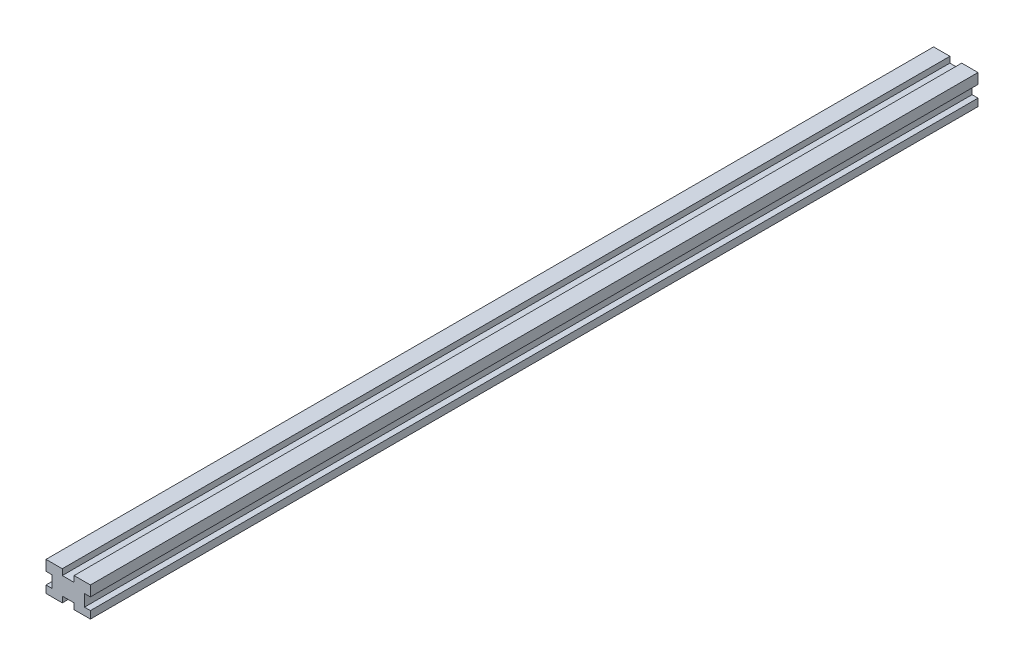
from build123d import *

# Parameters (mm, degrees)
SKETCH2_W           = 15
SKETCH2_H           = 10
BOSS_EXTRUDE2_DEPTH = 300
SKETCH5_W           = 4
SKETCH5_H           = 2
SKETCH5_W_2         = 2
SKETCH5_H_2         = 4
CUT_EXTRUDE1_DEPTH  = 301.135386118


with BuildPart() as part:
    # Sketch2 → Boss-Extrude2 (new body)
    with BuildSketch(Plane.XY):
        Rectangle(SKETCH2_W, SKETCH2_H)
    extrude(amount=BOSS_EXTRUDE2_DEPTH)

    # Sketch5 → Cut-Extrude1 (cut, through all)
    with BuildSketch(Plane.XY.offset(300)):
        with Locations((0, 4)):
            Rectangle(SKETCH5_W, SKETCH5_H)
        with Locations((6.5, -0.5)):
            Rectangle(SKETCH5_W_2, SKETCH5_H_2)
        with Locations((0, -4)):
            Rectangle(SKETCH5_W, SKETCH5_H)
        with Locations((-6.5, -0.5)):
            Rectangle(SKETCH5_W_2, SKETCH5_H_2)
    extrude(amount=-CUT_EXTRUDE1_DEPTH, mode=Mode.SUBTRACT)


solid = part.part
